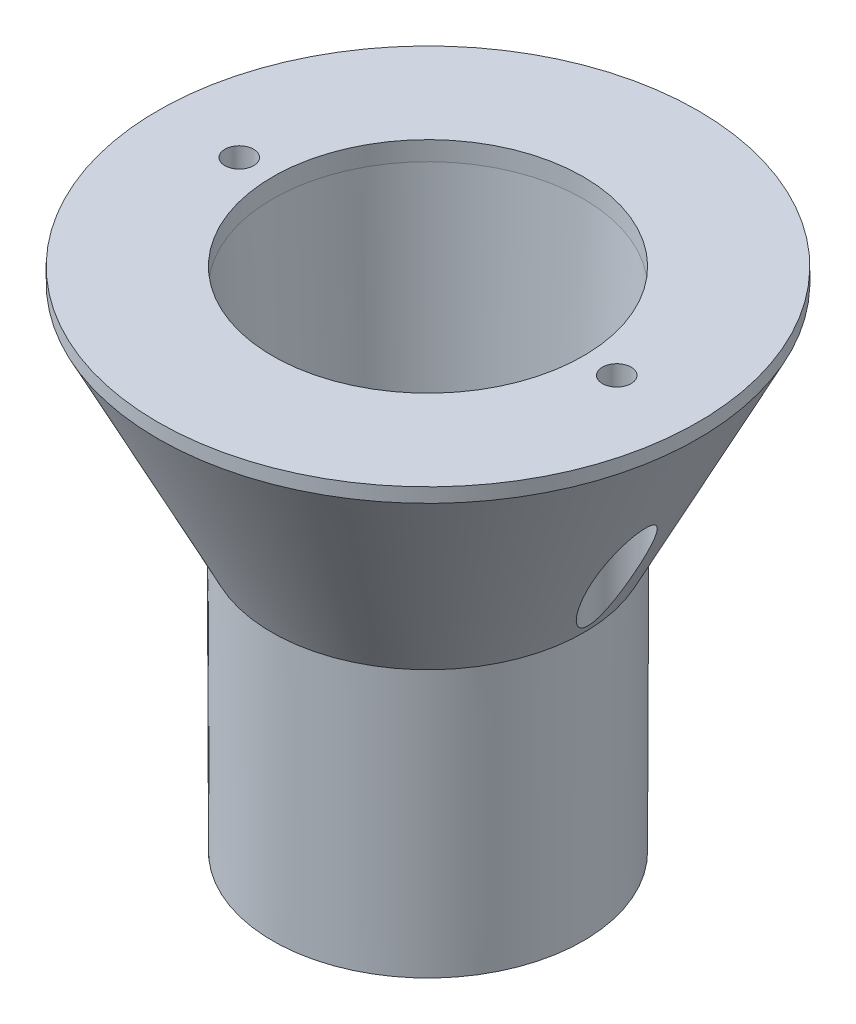
from build123d import *

# Parameters (mm, degrees)
SKETCH_2_R          = 3
CUT_EXTRUDE_3_DEPTH = 35
CUT_EXTRUDE_START   = -10
SKETCH_4_R          = 6
CUT_EXTRUDE_4_DEPTH = 52


with BuildPart() as part:
    # Эскиз1 → Повернуть2 (revolve)
    with BuildSketch(Plane.XY, mode=Mode.PRIVATE) as revolve_2_sk:
        Polygon((30, 0), (32.500012812, 0), (32.679297783, 56), (56.5, 103), (56.5, 106), (32.5, 106), (32.5, 102), (30.159832694, 49.92404441), align=None)
    revolve(revolve_2_sk.sketch.rotate(Axis((0, 0, 0), (0, 1, 0)), 90), axis=Axis((0, 0, 0), (0, 1, 0)))

    # Эскиз2 → Вырез-Вытянуть3 (cut)
    with BuildSketch(Plane(origin=(0, 106, 0), x_dir=(1, 0, 0), z_dir=(0, 1, 0))):
        with Locations(Location((-39.5, 0, 0), (0, 0, 270))):
            Circle(SKETCH_2_R)
    cut_extrude_3 = extrude(amount=-CUT_EXTRUDE_3_DEPTH, mode=Mode.SUBTRACT)

    # Зеркальное отражение1: Вырез-Вытянуть3 across plane
    add(cut_extrude_3.mirror(Plane(origin=(0, 0, 0), x_dir=(0, 0, 1), z_dir=(1, 0, 0))), mode=Mode.SUBTRACT)

    # Эскиз4 → Вырез-Вытянуть4 (cut)
    with BuildSketch(Plane(origin=(0, 56, 0), x_dir=(1, 0, 0), z_dir=(0, 1, 0)).offset(CUT_EXTRUDE_START)):
        with Locations(Location((39.5, 0, 0), (0, 0, 270))):
            Circle(SKETCH_4_R)
    cut_extrude_4 = extrude(amount=CUT_EXTRUDE_4_DEPTH, mode=Mode.SUBTRACT)

    # Зеркальное отражение2: Вырез-Вытянуть4 across plane
    add(cut_extrude_4.mirror(Plane(origin=(0, 0, 0), x_dir=(0, 0, 1), z_dir=(1, 0, 0))), mode=Mode.SUBTRACT)


solid = part.part
